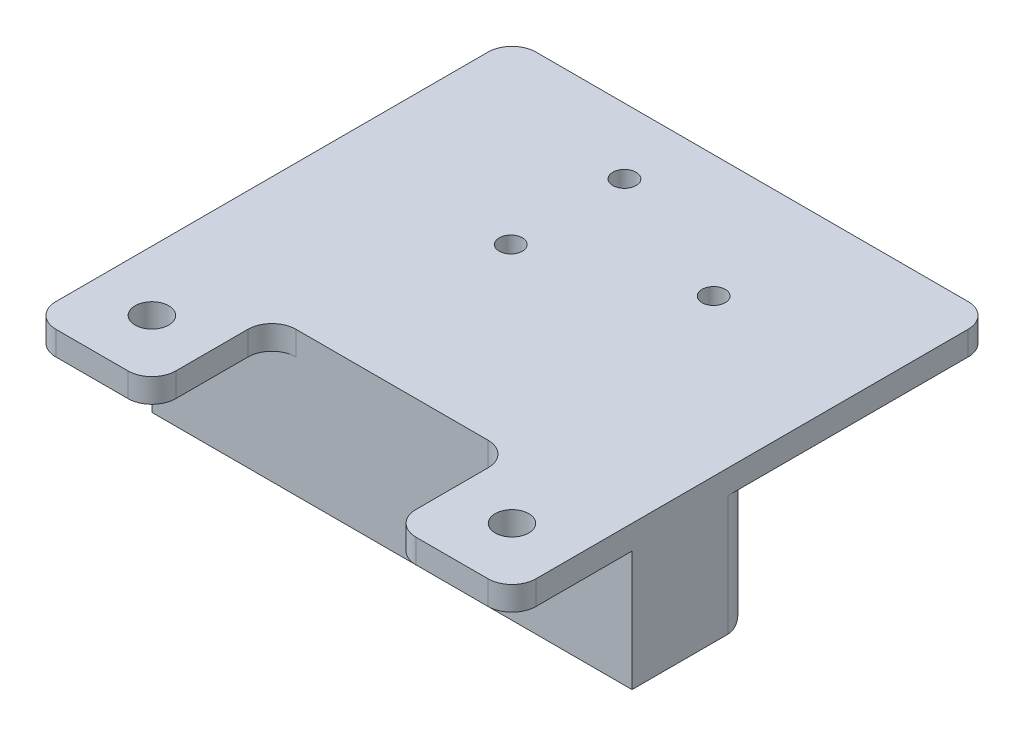
from build123d import *

# Parameters (mm, degrees)
SKETCH_1_R      = 2.1
SKETCH_1_R_2    = 1.45
EXTRUDE_1_DEPTH = 3
SKETCH_2_W      = 60
SKETCH_2_H      = 15
EXTRUDE_2_DEPTH = 15
FILLET_1_R      = 3


with BuildPart() as part:
    # 草图1 → 凸台-拉伸1 (new body)
    with BuildSketch(Plane(origin=(0, 0, 0), x_dir=(1, 0, 0), z_dir=(0, 1, 0))):
        Polygon((-15, 7.5), (-15, -7.5), (-30, -7.5), (-30, 52.5), (30, 52.5), (30, -7.5), (15, -7.5), (15, 7.5), align=None)
        with Locations(Location((-22.5, 0, 0), (0, 0, 270))):
            Circle(SKETCH_1_R, mode=Mode.SUBTRACT)
        with Locations(Location((22.5, 0, 0), (0, 0, 90))):
            Circle(SKETCH_1_R, mode=Mode.SUBTRACT)
        with Locations(Location((-7.75, 44.3, 0), (0, 0, 270))):
            Circle(SKETCH_1_R_2, mode=Mode.SUBTRACT)
        with Locations(Location((10.5, 37.2, 0), (0, 0, 270))):
            Circle(SKETCH_1_R_2, mode=Mode.SUBTRACT)
        with Locations(Location((-7.75, 30.1, 0), (0, 0, 270))):
            Circle(SKETCH_1_R_2, mode=Mode.SUBTRACT)
    extrude(amount=EXTRUDE_1_DEPTH)

    # 草图2 → 凸台-拉伸2 (add)
    with BuildSketch(Plane.XZ):
        with Locations((0, -15)):
            Rectangle(SKETCH_2_W, SKETCH_2_H)
    extrude(amount=EXTRUDE_2_DEPTH)

    # 圆角1
    fillet_1_edges = [part.edges().sort_by_distance(p)[0] for p in [
        (-30, 1.5, -52.5),
        (30, 1.5, -52.5),
        (30, 1.5, 7.5),
        (15, 1.5, 7.5),
        (15, 1.5, -7.5),
        (-15, 1.5, -7.5),
        (-15, 1.5, 7.5),
        (-30, 1.5, 7.5),
        (-30, -7.5, -22.5),
        (30, -7.5, -22.5),
        (0, -15, -22.5),
    ]]
    fillet(fillet_1_edges, radius=FILLET_1_R)


solid = part.part
